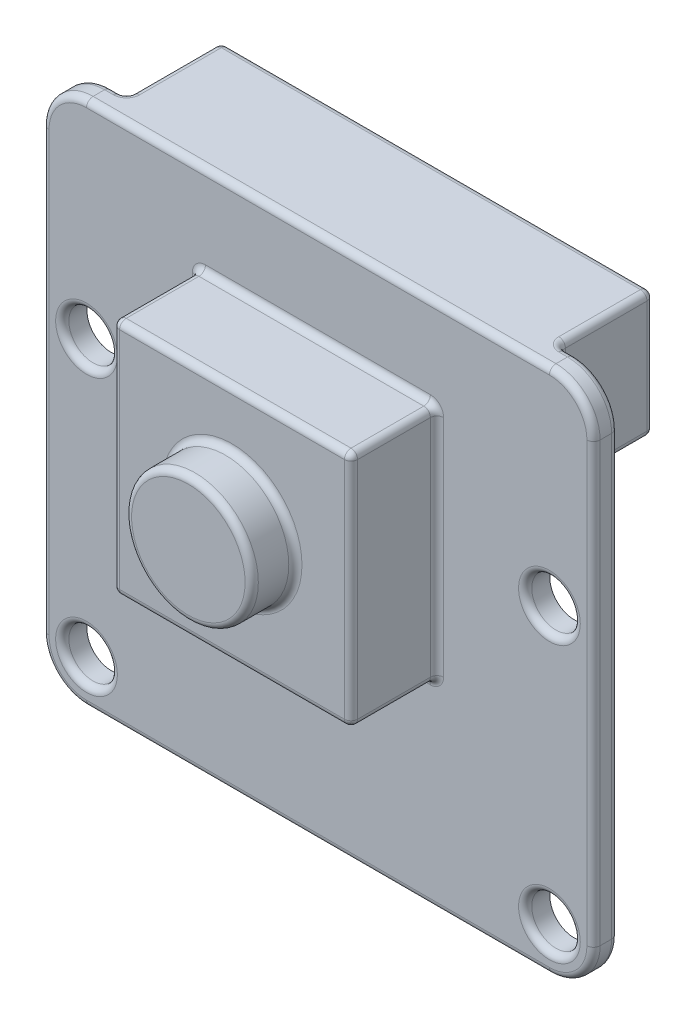
from build123d import *

# Parameters (mm, degrees)
SKETCH1_W           = 25
SKETCH1_H           = 23.87
BOSS_EXTRUDE1_DEPTH = 1.12
SKETCH2_W           = 10.8
SKETCH2_H           = 10.8
BOSS_EXTRUDE2_DEPTH = 3.9
SKETCH3_R           = 2.875
BOSS_EXTRUDE3_DEPTH = 1.98
SKETCH4_R           = 1.1
CUT_EXTRUDE1_DEPTH  = 7
FILLET1_R           = 2
SKETCH5_W           = 19.61
SKETCH5_H           = 5.71
BOSS_EXTRUDE4_DEPTH = 4.3
FILLET2_R           = 0.3
FILLET3_R           = 0.3


with BuildPart() as part:
    # Sketch1 → Boss-Extrude1 (new body)
    with BuildSketch(Plane.XY):
        Rectangle(SKETCH1_W, SKETCH1_H)
    extrude(amount=BOSS_EXTRUDE1_DEPTH)

    # Sketch2 → Boss-Extrude2 (add)
    with BuildSketch(Plane.XY.offset(1.12)):
        with Locations((0, 2.465)):
            Rectangle(SKETCH2_W, SKETCH2_H)
    extrude(amount=BOSS_EXTRUDE2_DEPTH)

    # Sketch3 → Boss-Extrude3 (add)
    with BuildSketch(Plane.XY.offset(5.02)):
        with Locations((0, 2.465)):
            Circle(SKETCH3_R)
    extrude(amount=BOSS_EXTRUDE3_DEPTH)

    # Sketch4 → Cut-Extrude1 (cut)
    with BuildSketch(Plane.XY.offset(1.12)):
        with Locations((-10.5, 2.565)):
            Circle(SKETCH4_R)
        with Locations((-10.5, -9.935)):
            Circle(SKETCH4_R)
        with Locations((10.5, -9.935)):
            Circle(SKETCH4_R)
        with Locations((10.5, 2.565)):
            Circle(SKETCH4_R)
    extrude(amount=-CUT_EXTRUDE1_DEPTH, mode=Mode.SUBTRACT)

    # Fillet1
    fillet1_edges = [part.edges().sort_by_distance(p)[0] for p in [
        (12.5, -11.935, 0.56),
        (-12.5, -11.935, 0.56),
        (-12.5, 11.935, 0.56),
        (12.5, 11.935, 0.56),
    ]]
    fillet(fillet1_edges, radius=FILLET1_R)

    # Sketch5 → Boss-Extrude4 (add)
    with BuildSketch(Plane(origin=(0, 0, 0), x_dir=(-1, 0, 0), z_dir=(0, 0, -1))):
        with Locations((0, 9.08)):
            Rectangle(SKETCH5_W, SKETCH5_H)
    extrude(amount=BOSS_EXTRUDE4_DEPTH)

    # Fillet2
    fillet2_edges = [part.edges().sort_by_distance(p)[0] for p in [
        (5.4, 2.465, 1.12),
        (5.4, -2.935, 3.07),
        (0, 7.865, 1.12),
        (5.4, 7.865, 3.07),
        (-5.4, 2.465, 1.12),
        (-5.4, 7.865, 3.07),
        (0, -2.935, 1.12),
        (-5.4, -2.935, 3.07),
        (5.4, 2.465, 5.02),
        (0, 7.865, 5.02),
        (-5.4, 2.465, 5.02),
        (0, -2.935, 5.02),
        (-2.875, 2.465, 5.02),
        (-2.875, 2.465, 7),
        (12.5, 0, 0),
        (0, -11.935, 0),
        (-12.5, 0, 0),
        (10.1525, 11.935, 0),
        (-11.914213562, 11.349213562, 0),
        (11.914213562, 11.349213562, 0),
        (-11.914213562, -11.349213562, 0),
        (11.914213562, -11.349213562, 0),
        (-10.1525, 11.935, 0),
        (0, 6.225, -4.3),
        (9.805, 6.225, -2.15),
        (0, 6.225, 0),
        (9.805, 9.08, -4.3),
        (9.805, 11.935, -2.15),
        (9.805, 9.08, 0),
        (0, 11.935, -4.3),
        (-9.805, 11.935, -2.15),
        (-9.805, 9.08, -4.3),
        (-9.805, 6.225, -2.15),
        (-9.805, 9.08, 0),
    ]]
    fillet(fillet2_edges, radius=FILLET2_R)

    # Fillet3
    fillet3_edges = [part.edges().sort_by_distance(p)[0] for p in [
        (9.4, 2.565, 1.12),
        (9.4, -9.935, 1.12),
        (-11.6, -9.935, 1.12),
        (-11.6, 2.565, 1.12),
        (12.5, 0, 1.12),
        (0, -11.935, 1.12),
        (0, 11.935, 1.12),
        (-12.5, 0, 1.12),
        (-11.914213562, 11.349213562, 1.12),
        (11.914213562, 11.349213562, 1.12),
        (-11.914213562, -11.349213562, 1.12),
        (11.914213562, -11.349213562, 1.12),
    ]]
    fillet(fillet3_edges, radius=FILLET3_R)


solid = part.part
